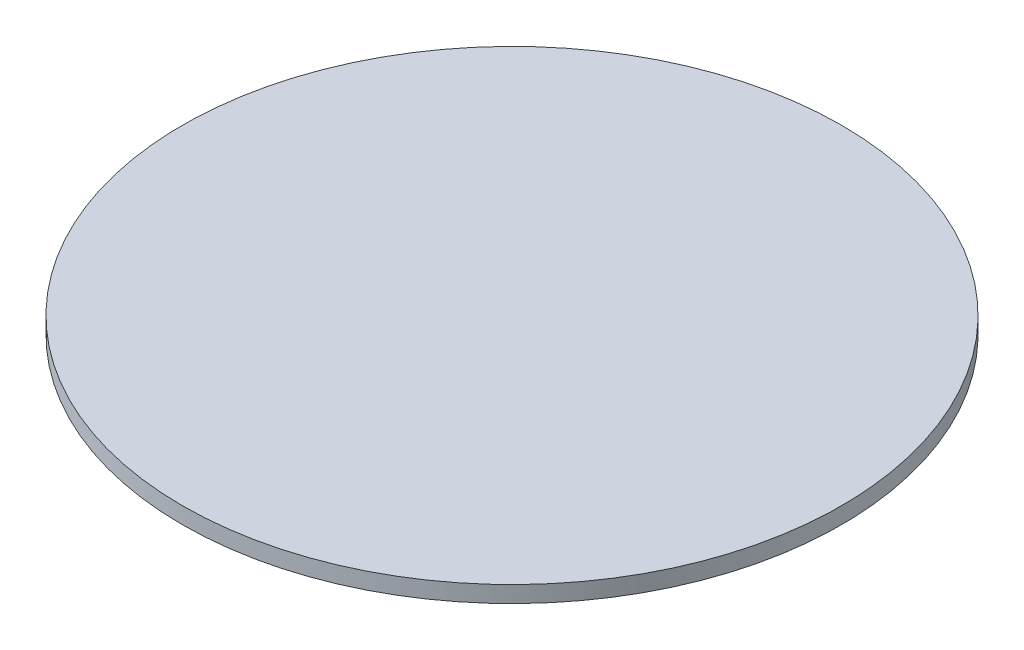
from build123d import *

# Parameters (mm, degrees)
SKETCH1_R           = 50
BOSS_EXTRUDE1_DEPTH = 2.5


with BuildPart() as part:
    # Sketch1 → Boss-Extrude1 (new body)
    with BuildSketch(Plane(origin=(0, 0, 0), x_dir=(1, 0, 0), z_dir=(0, 1, 0))):
        with Locations(Location((0, 0, 0), (0, 0, 270))):
            Circle(SKETCH1_R)
    extrude(amount=BOSS_EXTRUDE1_DEPTH)


solid = part.part
